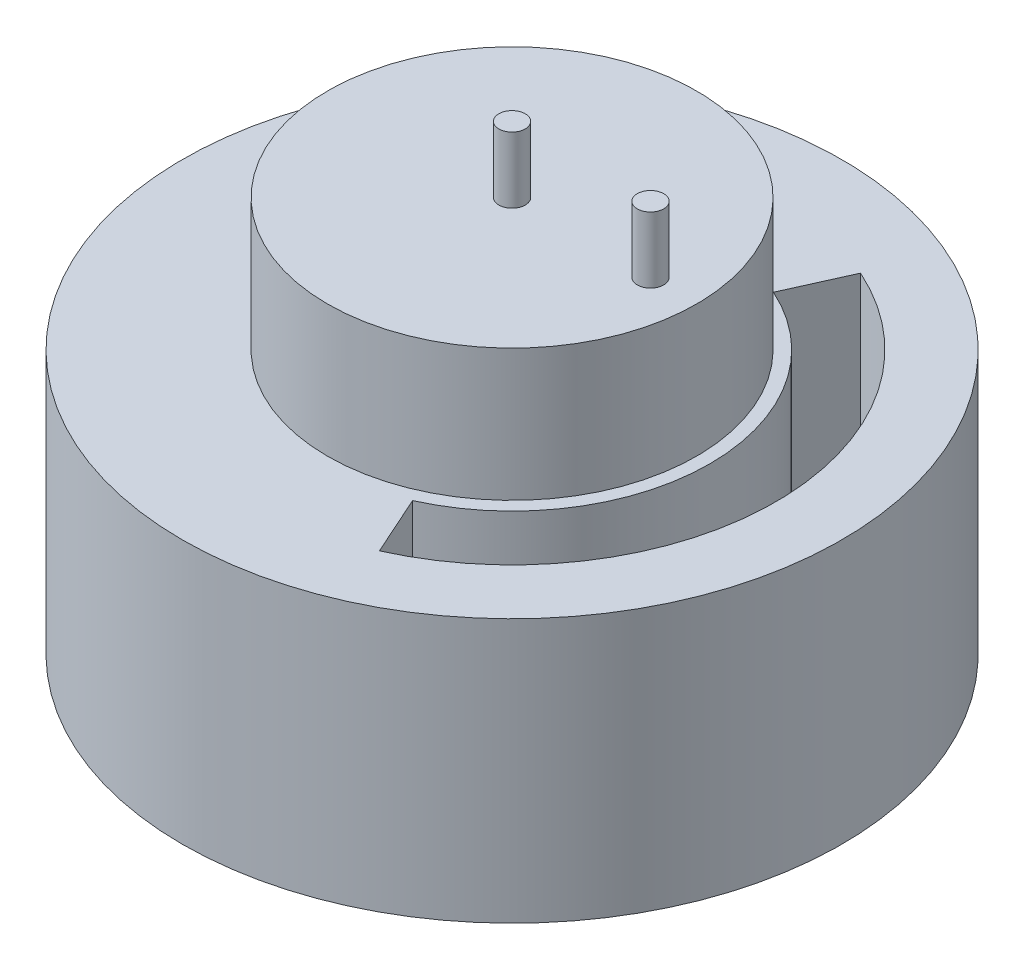
from build123d import *

# Parameters (mm, degrees)
RESSALTO_EXTRUS_O2_DEPTH = 20
ESBO_O3_R                = 14
BOSS_EXTRUDE1_DEPTH      = 10
SKETCH2_R                = 1
BOSS_EXTRUDE2_DEPTH      = 5
CUT_EXTRUDE2_DEPTH       = 20


with BuildPart() as part:
    # Esboço1 → Ressalto-extrusão2 (new body)
    with BuildSketch(Plane(origin=(0, 0, 0), x_dir=(1, 0, 0), z_dir=(0, 1, 0))):
        with BuildLine():
            ThreePointArc((-12.5, -21.650635095), (0, -25), (12.5, -21.650635095))
            ThreePointArc((12.5, -21.650635095), (21.650635095, -12.5), (25, 0))
            ThreePointArc((25, 0), (-12.5, 21.650635095), (-12.5, -21.650635095))
        make_face()
    extrude(amount=RESSALTO_EXTRUS_O2_DEPTH)

    # Esboço3 → Boss-Extrude1 (add)
    with BuildSketch(Plane(origin=(0, 20, 0), x_dir=(1, 0, 0), z_dir=(0, 1, 0))):
        with Locations(Location((0, 0, 0), (0, 0, 270))):
            Circle(ESBO_O3_R)
    extrude(amount=BOSS_EXTRUDE1_DEPTH)

    # Sketch2 → Boss-Extrude2 (add)
    with BuildSketch(Plane(origin=(0, 30, 0), x_dir=(1, 0, 0), z_dir=(0, 1, 0))):
        with Locations(Location((0, 0, 0), (0, 0, 270))):
            Circle(SKETCH2_R)
        with Locations(Location((10.5, 0, 0), (0, 0, 270))):
            Circle(SKETCH2_R)
    extrude(amount=BOSS_EXTRUDE2_DEPTH)

    # Sketch3 → Cut-Extrude2 (cut)
    with BuildSketch(Plane(origin=(0, 20, 0), x_dir=(1, 0, 0), z_dir=(0, 1, 0))):
        with BuildLine():
            Line((8.185723081, -18.248121483), (6.13929231, -13.686091112))
            ThreePointArc((6.13929231, -13.686091112), (15, 0), (6.13929231, 13.686091112))
            Line((6.13929231, 13.686091112), (8.185723081, 18.248121483))
            ThreePointArc((8.185723081, 18.248121483), (20, 0), (8.185723081, -18.248121483))
        make_face()
    extrude(amount=-CUT_EXTRUDE2_DEPTH, mode=Mode.SUBTRACT)


solid = part.part
